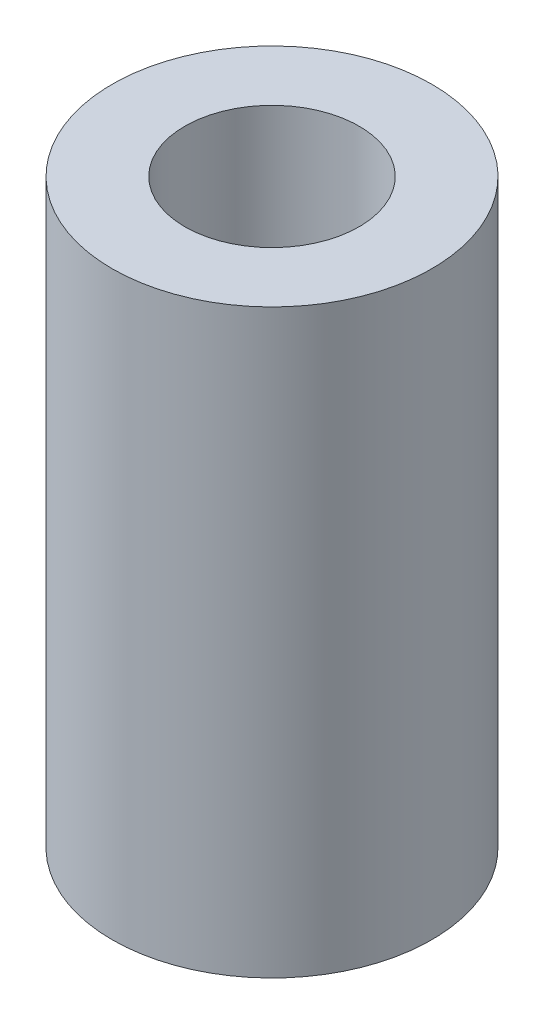
from build123d import *

# Parameters (mm, degrees)
SKETCH1_R           = 3.3
SKETCH1_R_2         = 1.8
BOSS_EXTRUDE1_DEPTH = 12


with BuildPart() as part:
    # Sketch1 → Boss-Extrude1 (new body)
    with BuildSketch(Plane(origin=(0, 0, 0), x_dir=(1, 0, 0), z_dir=(0, 1, 0))):
        with Locations(Location((0, 0, 0), (0, 0, 270))):
            Circle(SKETCH1_R)
        with Locations(Location((0, 0, 0), (0, 0, 270))):
            Circle(SKETCH1_R_2, mode=Mode.SUBTRACT)
    extrude(amount=BOSS_EXTRUDE1_DEPTH)


solid = part.part
